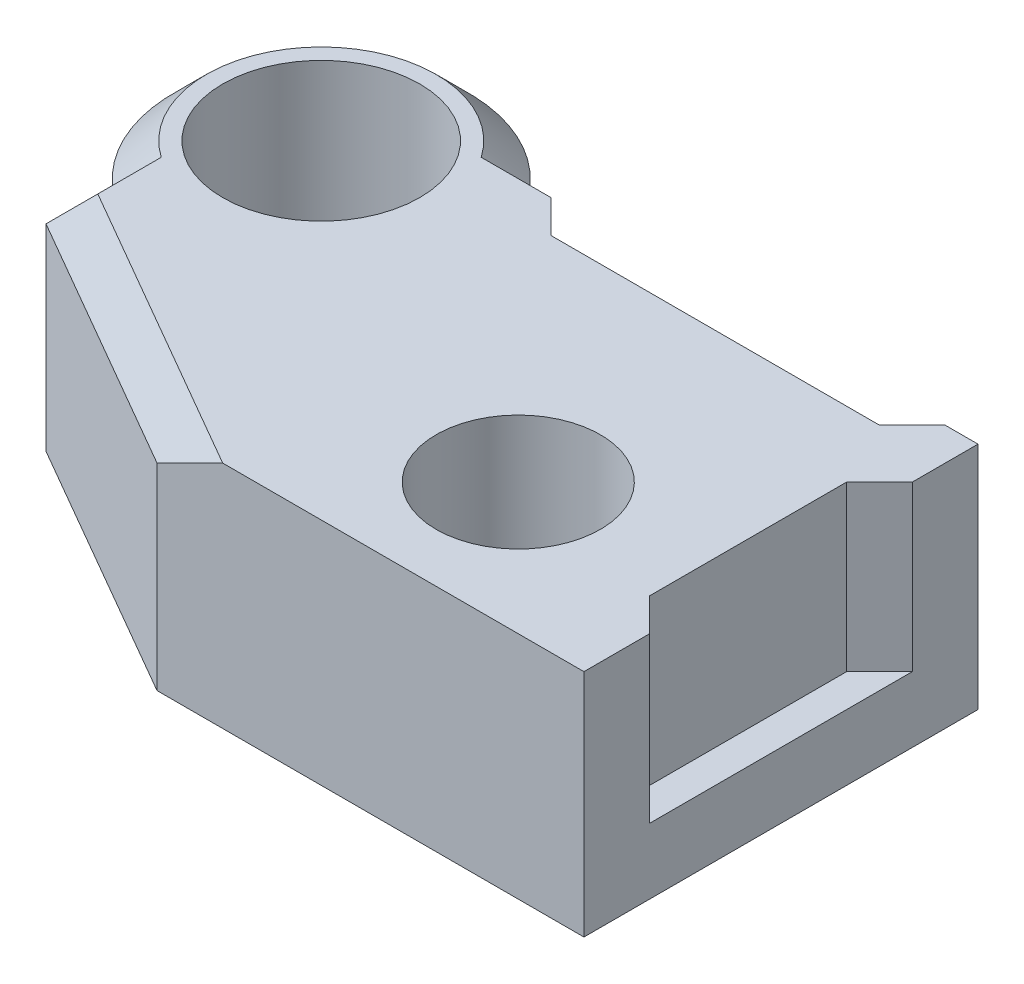
from build123d import *

# Parameters (mm, degrees)
BOSS_EXTRUDE1_DEPTH     = 35
CUT_EXTRUDE3_DEPTH      = 84.964278119
CUT_EXTRUDE3_DEPTH_BACK = 84.964278119
SKETCH2_R               = 12.5
SKETCH2_R_2             = 15
CUT_EXTRUDE4_START      = 10
CUT_EXTRUDE4_DEPTH      = 25
CHAMFER1_SIZE           = 5


with BuildPart() as part:
    # Sketch1 → Boss-Extrude1 (new body)
    with BuildSketch(Plane(origin=(0, 0, 0), x_dir=(1, 0, 0), z_dir=(0, 1, 0))):
        with BuildLine():
            Line((-40, -16.905989232), (0, -40))
            Line((0, -40), (65, -40))
            Line((65, -40), (65, 20))
            Line((65, 20), (-4.844355629, 20))
            ThreePointArc((-4.844355629, 20), (-38.631222116, 27.900831925), (-40, -6.770509831))
            Line((-40, -6.770509831), (-40, -16.905989232))
        make_face()
    extrude(amount=BOSS_EXTRUDE1_DEPTH)

    # Sketch2 → Cut-Extrude3 (cut, two sides: drawn at the far end of the back side and taken through both)
    with BuildSketch(Plane(origin=(0, 0, 0), x_dir=(1, 0, 0), z_dir=(0, 1, 0)).offset(-CUT_EXTRUDE3_DEPTH_BACK)):
        with Locations(Location((35, -20, 0), (0, 0, 270))):
            Circle(SKETCH2_R)
        with Locations(Location((-25, 10, 0), (0, 0, 270))):
            Circle(SKETCH2_R_2)
    extrude(amount=CUT_EXTRUDE3_DEPTH + CUT_EXTRUDE3_DEPTH_BACK, mode=Mode.SUBTRACT)

    # Sketch3 → Cut-Extrude4 (cut)
    with BuildSketch(Plane(origin=(0, 0, 0), x_dir=(1, 0, 0), z_dir=(0, 1, 0)).offset(CUT_EXTRUDE4_START)):
        Polygon((0, 20), (60, 20), (55, 15), (5, 15), align=None)
        Polygon((65, 10), (65, -30), (60, -25), (60, 5), align=None)
    extrude(amount=CUT_EXTRUDE4_DEPTH, mode=Mode.SUBTRACT)

    # Chamfer1
    chamfer1_edges = [part.edges().sort_by_distance(p)[0] for p in [
        (-20, 35, 28.452994616),
        (-40, 35, 11.838249532),
        (-38.631222116, 35, -27.900831925),
    ]]
    chamfer(chamfer1_edges, length=CHAMFER1_SIZE)


solid = part.part
